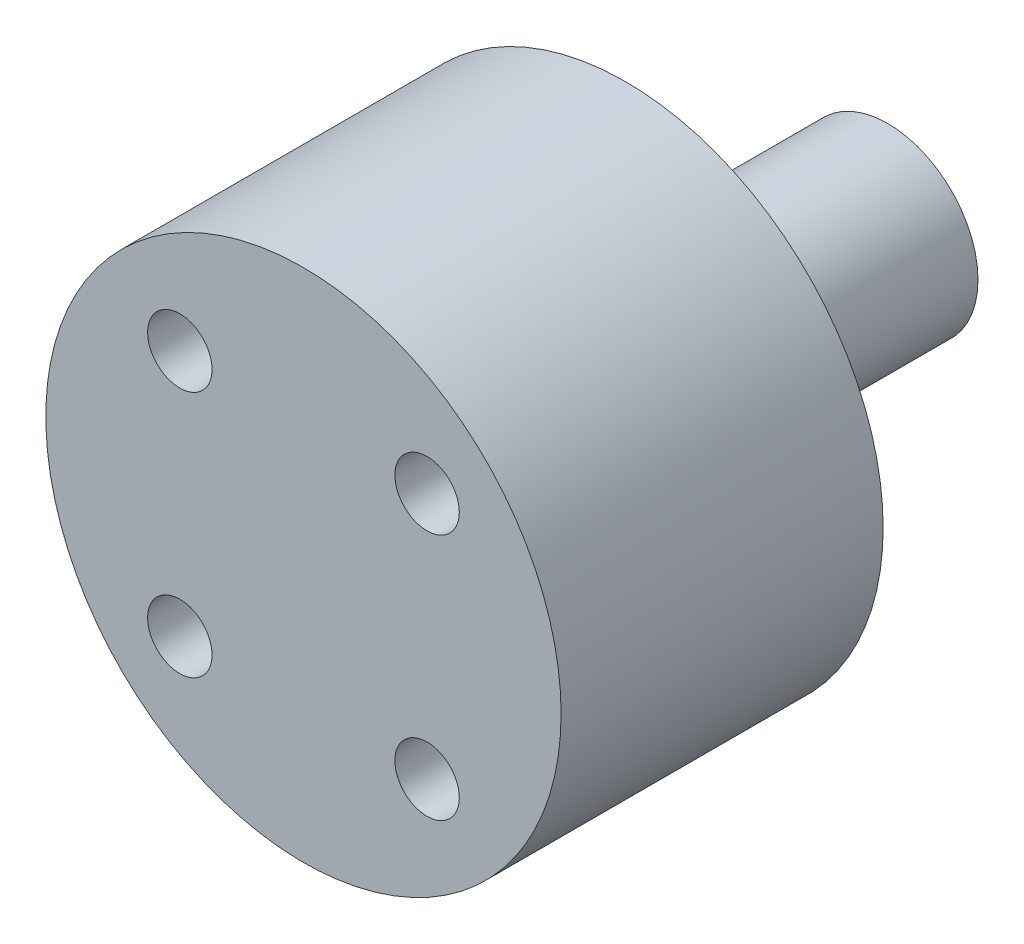
from build123d import *

# Parameters (mm, degrees)
ESQUISSE1_R        = 14
ESQUISSE1_R_2      = 1.75
BOSS_EXTRU_1_DEPTH = 17.5
ESQUISSE2_R        = 4.904077813
BOSS_EXTRU_2_DEPTH = 14.25


with BuildPart() as part:
    # Esquisse1 → Boss.-Extru.1 (new body)
    with BuildSketch(Plane.XY):
        Circle(ESQUISSE1_R)
        with Locations((-6.717514421, 6.717514421)):
            Circle(ESQUISSE1_R_2, mode=Mode.SUBTRACT)
        with Locations((6.717514421, 6.717514421)):
            Circle(ESQUISSE1_R_2, mode=Mode.SUBTRACT)
        with Locations((6.717514421, -6.717514421)):
            Circle(ESQUISSE1_R_2, mode=Mode.SUBTRACT)
        with Locations((-6.717514421, -6.717514421)):
            Circle(ESQUISSE1_R_2, mode=Mode.SUBTRACT)
    extrude(amount=BOSS_EXTRU_1_DEPTH)

    # Esquisse2 → Boss.-Extru.2 (add)
    with BuildSketch(Plane(origin=(0, 0, 0), x_dir=(-1, 0, 0), z_dir=(0, 0, -1))):
        with Locations(Location((0, 0, 0), (0, 0, 180))):
            Circle(ESQUISSE2_R)
    extrude(amount=BOSS_EXTRU_2_DEPTH)


solid = part.part
